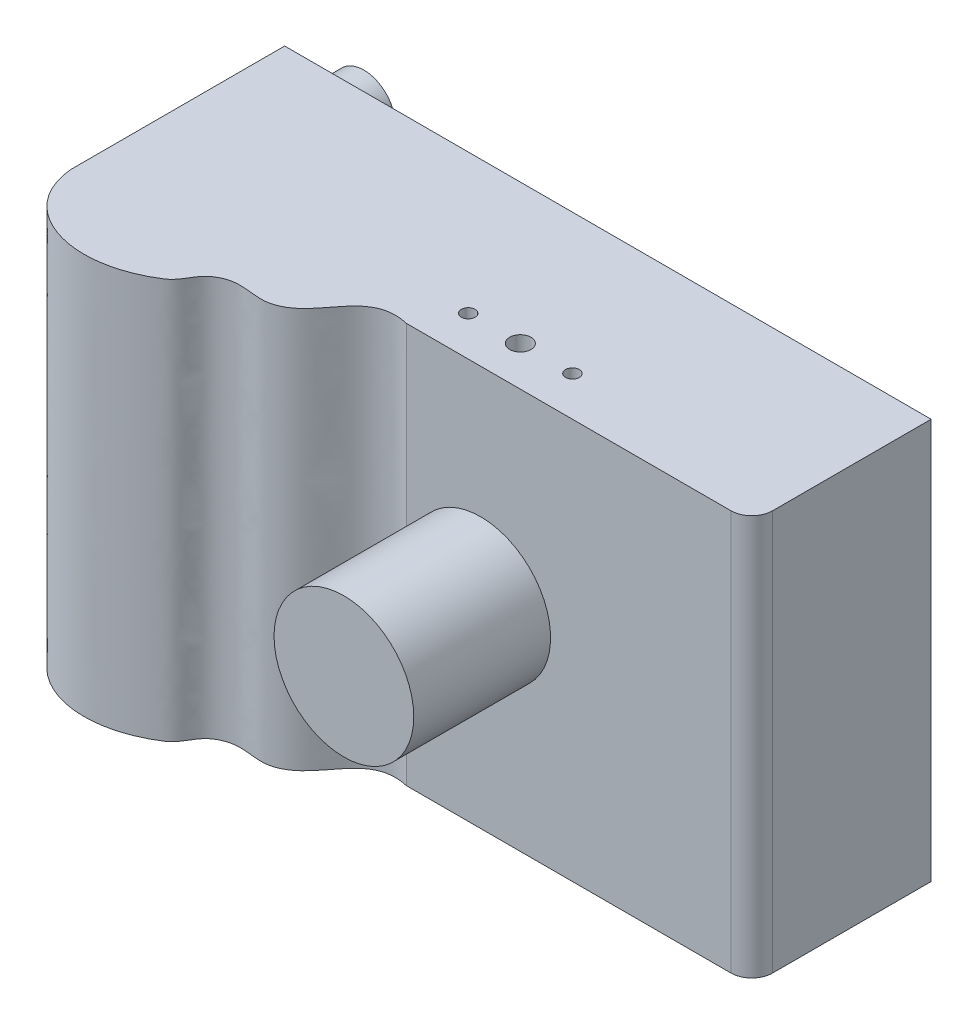
from build123d import *

# Parameters (mm, degrees)
BOSS_EXTRUDE2_DEPTH         = 96
F_1_4_20_TAPPED_HOLE1_D     = 5.1054
F_1_4_20_TAPPED_HOLE1_DEPTH = 11.81
F_1_4_20_TAPPED_HOLE1_TIP   = 1.533816902
M4X0_7_TAPPED_HOLE1_D       = 3.3
M4X0_7_TAPPED_HOLE1_DEPTH   = 8
M4X0_7_TAPPED_HOLE1_TIP     = 0.991420021
F_1_4_20_TAPPED_HOLE2_D     = 5.1054
F_1_4_20_TAPPED_HOLE2_DEPTH = 8
F_1_4_20_TAPPED_HOLE2_TIP   = 1.533816902
M4X0_7_TAPPED_HOLE2_D       = 3.3
M4X0_7_TAPPED_HOLE2_DEPTH   = 8
M4X0_7_TAPPED_HOLE2_TIP     = 0.991420021
F_1_4_20_TAPPED_HOLE3_D     = 5.1054
F_1_4_20_TAPPED_HOLE3_DEPTH = 8
F_1_4_20_TAPPED_HOLE3_TIP   = 1.533816902
M4X0_7_TAPPED_HOLE3_D       = 3.3
M4X0_7_TAPPED_HOLE3_DEPTH   = 8
M4X0_7_TAPPED_HOLE3_TIP     = 0.991420021
SKETCH18_R                  = 15
BOSS_EXTRUDE3_DEPTH         = 7
SKETCH19_R                  = 16.75
BOSS_EXTRUDE4_DEPTH         = 32.8
SKETCH21_R                  = 7.5
BOSS_EXTRUDE5_DEPTH         = 8


with BuildPart() as part:
    # Sketch3 → Boss-Extrude2 (new body)
    with BuildSketch(Plane(origin=(0, 0, 0), x_dir=(1, 0, 0), z_dir=(0, 1, 0))):
        with BuildLine():
            Line((-77.5, 33.713374541), (77.5, 33.713374541))
            Line((77.5, 33.713374541), (77.5, -4.286625459))
            ThreePointArc((77.5, -4.286625459), (76.035533906, -7.822159365), (72.5, -9.286625459))
            Line((72.5, -9.286625459), (-5.34280429, -9.286625459))
            add(Edge.make_bspline(
                [(-77.5, -17.592632334), (-76.531586921, -27.812364706), (-63.183365133, -36.225526643), (-48.309869967, -32.191560801), (-41.548221394, -27.791577279), (-39.923317307, -23.252890407), (-33.51659169, -20.402804079), (-27.636821931, -22.457279743), (-17.016494344, -17.99263357), (-15.451468691, -6.931628422), (-5.34280429, -9.286625459)],
                knots=[0, 0, 0, 0, 0.287416321, 0.468367966, 0.496457191, 0.560076213, 0.621962162, 0.714917343, 0.75940227, 1, 1, 1, 1], degree=3))
            Line((-77.5, -17.592632334), (-77.5, 33.713374541))
        make_face()
    extrude(amount=BOSS_EXTRUDE2_DEPTH)

    # 1/4-20 Tapped Hole1
    with Locations(Plane.ZY.offset(77.5)):
        with Locations((-0.213374541, 47.5)):
            Hole(F_1_4_20_TAPPED_HOLE1_D / 2, depth=F_1_4_20_TAPPED_HOLE1_DEPTH)
            with Locations((0, 0, -(F_1_4_20_TAPPED_HOLE1_DEPTH + F_1_4_20_TAPPED_HOLE1_TIP / 2))):  # 118° drill point
                Cone(0, F_1_4_20_TAPPED_HOLE1_D / 2, F_1_4_20_TAPPED_HOLE1_TIP, mode=Mode.SUBTRACT)

    # M4x0.7 Tapped Hole1
    with Locations(Plane.ZY.offset(77.5)):
        with Locations((-0.213374541, 85), (-0.213374541, 10)):
            Hole(M4X0_7_TAPPED_HOLE1_D / 2, depth=M4X0_7_TAPPED_HOLE1_DEPTH)
            with Locations((0, 0, -(M4X0_7_TAPPED_HOLE1_DEPTH + M4X0_7_TAPPED_HOLE1_TIP / 2))):  # 118° drill point
                Cone(0, M4X0_7_TAPPED_HOLE1_D / 2, M4X0_7_TAPPED_HOLE1_TIP, mode=Mode.SUBTRACT)

    # 1/4-20 Tapped Hole2
    with Locations(Plane(origin=(0, 0, 0), x_dir=(-1, 0, 0), z_dir=(0, -1, 0))):
        with Locations((-12.5, 10.213374541)):
            Hole(F_1_4_20_TAPPED_HOLE2_D / 2, depth=F_1_4_20_TAPPED_HOLE2_DEPTH)
            with Locations((0, 0, -(F_1_4_20_TAPPED_HOLE2_DEPTH + F_1_4_20_TAPPED_HOLE2_TIP / 2))):  # 118° drill point
                Cone(0, F_1_4_20_TAPPED_HOLE2_D / 2, F_1_4_20_TAPPED_HOLE2_TIP, mode=Mode.SUBTRACT)

    # M4x0.7 Tapped Hole2
    with Locations(Plane(origin=(0, 0, 0), x_dir=(-1, 0, 0), z_dir=(0, -1, 0))):
        with Locations((0, 0.213374541), (-25, 0.213374541)):
            Hole(M4X0_7_TAPPED_HOLE2_D / 2, depth=M4X0_7_TAPPED_HOLE2_DEPTH)
            with Locations((0, 0, -(M4X0_7_TAPPED_HOLE2_DEPTH + M4X0_7_TAPPED_HOLE2_TIP / 2))):  # 118° drill point
                Cone(0, M4X0_7_TAPPED_HOLE2_D / 2, M4X0_7_TAPPED_HOLE2_TIP, mode=Mode.SUBTRACT)

    # 1/4-20 Tapped Hole3
    with Locations(Plane(origin=(0, 96, 0), x_dir=(1, 0, 0), z_dir=(0, 1, 0))):
        with Locations((12.5, 0.213374541)):
            Hole(F_1_4_20_TAPPED_HOLE3_D / 2, depth=F_1_4_20_TAPPED_HOLE3_DEPTH)
            with Locations((0, 0, -(F_1_4_20_TAPPED_HOLE3_DEPTH + F_1_4_20_TAPPED_HOLE3_TIP / 2))):  # 118° drill point
                Cone(0, F_1_4_20_TAPPED_HOLE3_D / 2, F_1_4_20_TAPPED_HOLE3_TIP, mode=Mode.SUBTRACT)

    # M4x0.7 Tapped Hole3
    with Locations(Plane(origin=(0, 96, 0), x_dir=(1, 0, 0), z_dir=(0, 1, 0))):
        with Locations((25, 0.213374541), (0, 0.213374541)):
            Hole(M4X0_7_TAPPED_HOLE3_D / 2, depth=M4X0_7_TAPPED_HOLE3_DEPTH)
            with Locations((0, 0, -(M4X0_7_TAPPED_HOLE3_DEPTH + M4X0_7_TAPPED_HOLE3_TIP / 2))):  # 118° drill point
                Cone(0, M4X0_7_TAPPED_HOLE3_D / 2, M4X0_7_TAPPED_HOLE3_TIP, mode=Mode.SUBTRACT)

    # Sketch18 → Boss-Extrude3 (add)
    with BuildSketch(Plane.XY.offset(9.286625459)):
        with Locations(Location((12.5, 48, 0), (0, 0, 180))):
            Circle(SKETCH18_R)
    extrude(amount=BOSS_EXTRUDE3_DEPTH)

    # Sketch19 → Boss-Extrude4 (add)
    with BuildSketch(Plane.XY.offset(9.286625459)):
        with Locations(Location((12.5, 48, 0), (0, 0, 180))):
            Circle(SKETCH19_R)
    extrude(amount=BOSS_EXTRUDE4_DEPTH)

    # Sketch21 → Boss-Extrude5 (add)
    with BuildSketch(Plane(origin=(0, 0, -33.713374541), x_dir=(-1, 0, 0), z_dir=(0, 0, -1))):
        with Locations(Location((66.5, 85, 0), (0, 0, 180))):
            Circle(SKETCH21_R)
    extrude(amount=BOSS_EXTRUDE5_DEPTH)


solid = part.part
